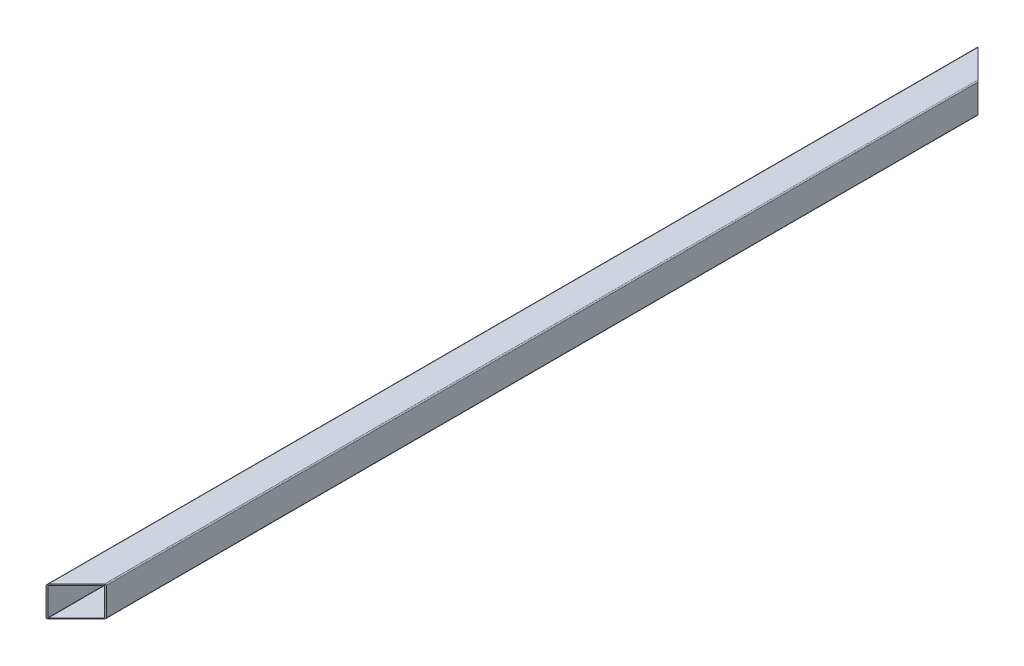
from build123d import *

# Parameters (mm, degrees)
STRUCTURAL_MEMBER1_DEPTH = 1236
CUT_EXTRUDE1_DEPTH       = 50


with BuildPart() as part:
    # Sketch12 → Structural Member1 (new body)
    with BuildSketch(Plane(origin=(0, 0, 0), x_dir=(-1, 0, 0), z_dir=(0, 0, -1))):
        with BuildLine():
            Line((-18.5, -20), (18.5, -20))
            ThreePointArc((18.5, -20), (19.560660172, -19.560660172), (20, -18.5))
            Line((20, -18.5), (20, 18.5))
            ThreePointArc((20, 18.5), (19.560660172, 19.560660172), (18.5, 20))
            Line((18.5, 20), (-18.5, 20))
            ThreePointArc((-18.5, 20), (-19.560660172, 19.560660172), (-20, 18.5))
            Line((-20, 18.5), (-20, -18.5))
            ThreePointArc((-20, -18.5), (-19.560660172, -19.560660172), (-18.5, -20))
        make_face()
        with BuildLine():
            Line((-18.5, -18.8), (18.5, -18.8))
            ThreePointArc((18.5, -18.8), (18.712132034, -18.712132034), (18.8, -18.5))
            Line((18.8, -18.5), (18.8, 18.5))
            ThreePointArc((18.8, 18.5), (18.712132034, 18.712132034), (18.5, 18.8))
            Line((18.5, 18.8), (-18.5, 18.8))
            ThreePointArc((-18.5, 18.8), (-18.712132034, 18.712132034), (-18.8, 18.5))
            Line((-18.8, 18.5), (-18.8, -18.5))
            ThreePointArc((-18.8, -18.5), (-18.712132034, -18.712132034), (-18.5, -18.8))
        make_face(mode=Mode.SUBTRACT)
    extrude(amount=STRUCTURAL_MEMBER1_DEPTH)

    # Sketch13 → Cut-Extrude1 (cut)
    with BuildSketch(Plane(origin=(0, 20, 0), x_dir=(1, 0, 0), z_dir=(0, 1, 0))):
        Polygon((-20, 1236), (33.292001776, 1182.707998224), (17.414648523, 1269.864771323), align=None)
        Polygon((17.414648523, -33.864771323), (-20, 0), (33.292001776, 53.292001776), align=None)
    extrude(amount=-CUT_EXTRUDE1_DEPTH, mode=Mode.SUBTRACT)


solid = part.part
